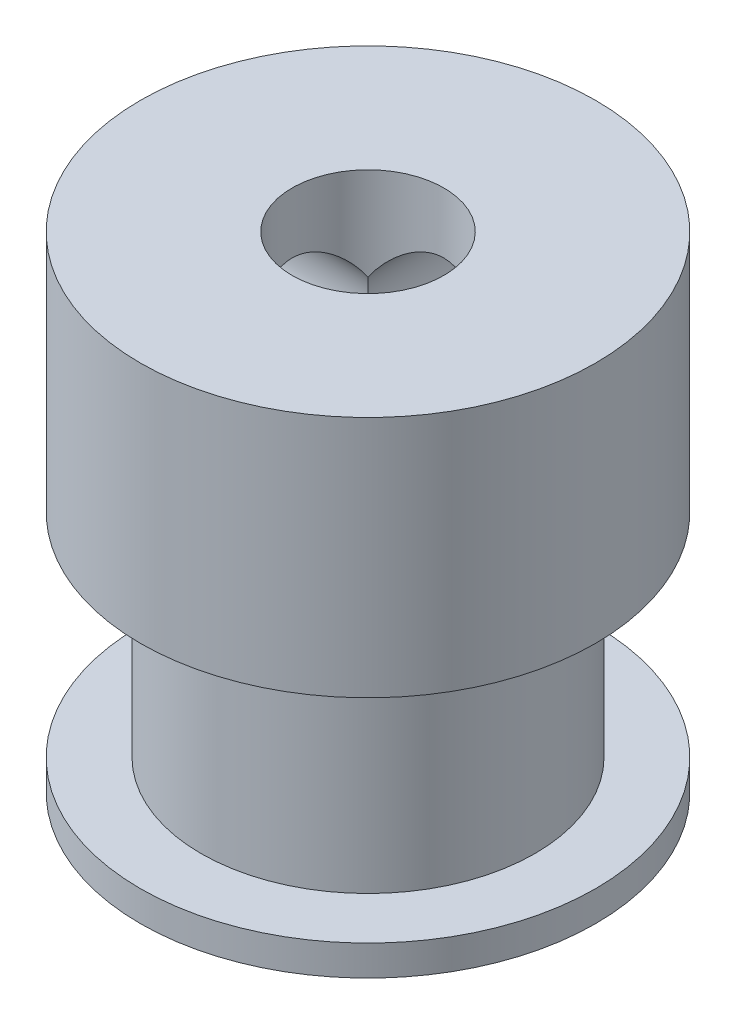
from build123d import *

# Parameters (mm, degrees)
ESQUISSE1_R                  = 7.5
BOSS_EXTRU_1_DEPTH           = 16
ESQUISSE2_W                  = 2
ESQUISSE2_H                  = 7
ESQUISSE3_R                  = 2.5
ENL_V_MAT_EXTRU_1_DEPTH      = 16
ESQUISSE4_R                  = 2
ENL_V_MAT_EXTRU_2_DEPTH      = 20.19635382
R_P_TITION_CIRCULAIRE1_COUNT = 2
R_P_TITION_CIRCULAIRE1_ANGLE = 90


with BuildPart() as part:
    # Esquisse1 → Boss.-Extru.1 (new body)
    with BuildSketch(Plane(origin=(0, 0, 0), x_dir=(1, 0, 0), z_dir=(0, 1, 0))):
        with Locations(Location((0, 0, 0), (0, 0, 270))):
            Circle(ESQUISSE1_R)
    extrude(amount=BOSS_EXTRU_1_DEPTH)

    # Esquisse2 → Enlèvement de matière-Révolution1 (revolve, cut)
    with BuildSketch(Plane(origin=(0, 0, 0), x_dir=(0, 0, -1), z_dir=(1, 0, 0)), mode=Mode.PRIVATE) as enl_vement_de_mati_re_r_volution1_sk:
        with Locations((-6.5, 4.5)):
            Rectangle(ESQUISSE2_W, ESQUISSE2_H)
    revolve(enl_vement_de_mati_re_r_volution1_sk.sketch.rotate(Axis((0, 0, 0), (0, 1, 0)), 180), axis=Axis((0, 0, 0), (0, 1, 0)), mode=Mode.SUBTRACT)

    # Esquisse3 → Enlèv. mat.-Extru.1 (cut)
    with BuildSketch(Plane(origin=(0, 16, 0), x_dir=(1, 0, 0), z_dir=(0, 1, 0))):
        with Locations(Location((0, 0, 0), (0, 0, 270))):
            Circle(ESQUISSE3_R)
    extrude(amount=-ENL_V_MAT_EXTRU_1_DEPTH, mode=Mode.SUBTRACT)

    # Esquisse4 → Enlèv. mat.-Extru.2 (cut, through all)
    with BuildSketch(Plane.XY):
        with Locations((0, 12)):
            Circle(ESQUISSE4_R)
    enl_v_mat_extru_2 = extrude(amount=-ENL_V_MAT_EXTRU_2_DEPTH, mode=Mode.SUBTRACT)

    # Répétition circulaire1: Enlèv. mat.-Extru.2 ×2 about axis
    r_p_tition_circulaire1_axis = Axis((0, 16, 0), (0, 1, 0))
    for i in range(1, R_P_TITION_CIRCULAIRE1_COUNT):
        add(enl_v_mat_extru_2.rotate(r_p_tition_circulaire1_axis, i * R_P_TITION_CIRCULAIRE1_ANGLE / (R_P_TITION_CIRCULAIRE1_COUNT - 1)), mode=Mode.SUBTRACT)


solid = part.part
